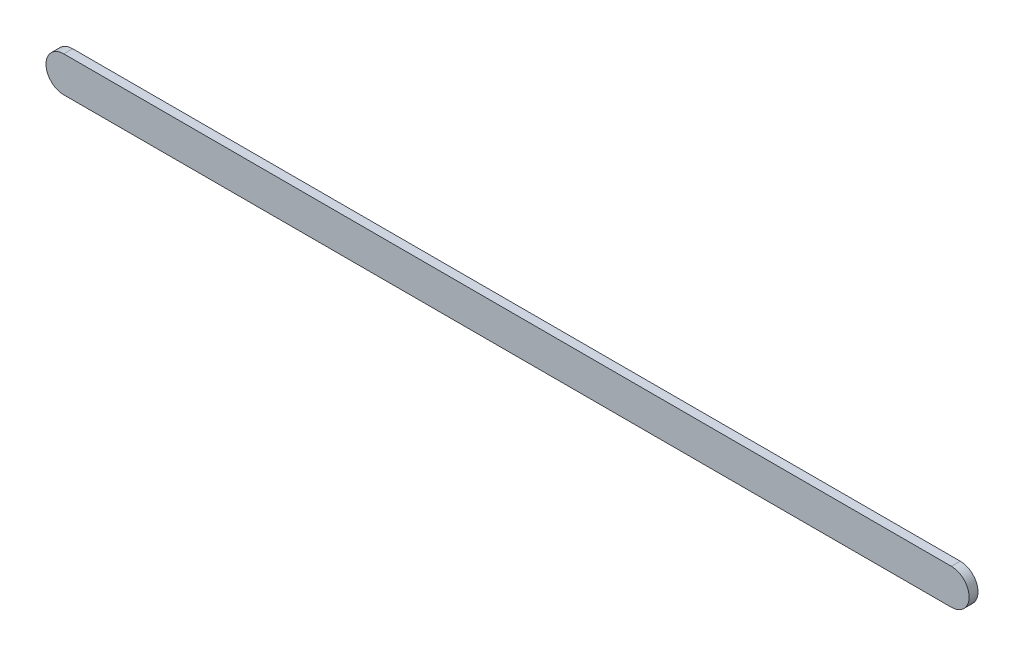
from build123d import *

# Parameters (mm, degrees)
BOSS_EXTRUDE1_DEPTH = 2.5


with BuildPart() as part:
    # Sketch3 → Boss-Extrude1 (new body)
    with BuildSketch(Plane.XY):
        with BuildLine():
            Line((0, 5), (250, 5))
            ThreePointArc((250, 5), (255, 0), (250, -5))
            Line((250, -5), (0, -5))
            ThreePointArc((0, -5), (-5, 0), (0, 5))
        make_face()
    extrude(amount=BOSS_EXTRUDE1_DEPTH)


solid = part.part
